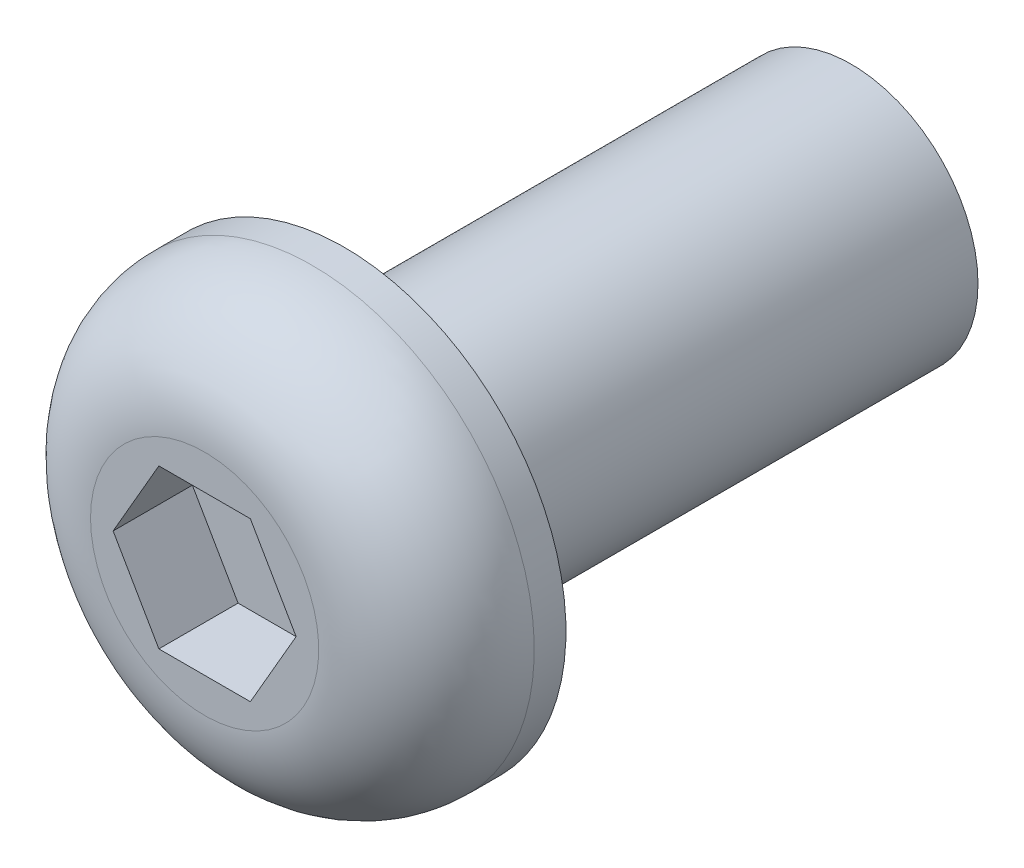
from build123d import *

# Parameters (mm, degrees)
SKETCH1_R          = 4
EXTRUDE1_DEPTH     = 16
CUT_EXTRUDE1_DEPTH = 2.5


with BuildPart() as part:
    # Sketch1 → Extrude1 (new body)
    with BuildSketch(Plane.XY):
        Circle(SKETCH1_R)
    extrude(amount=-EXTRUDE1_DEPTH)

    # Sketch2 → Revolve1 (revolve)
    with BuildSketch(Plane(origin=(0, 0, 0), x_dir=(0, 0, -1), z_dir=(1, 0, 0)), mode=Mode.PRIVATE) as revolve1_sk:
        with BuildLine():
            Line((0, 0), (0, 7))
            Line((0, 7), (-1, 7))
            ThreePointArc((-1, 7), (-3.404163056, 6.004163056), (-4.4, 3.6))
            Line((-4.4, 3.6), (-4.4, 0))
            Line((-4.4, 0), (0, 0))
        make_face()
    revolve(revolve1_sk.sketch.rotate(Axis((0, 0, 0), (0, 0, 1)), 90), axis=Axis((0, 0, 0), (0, 0, 1)))

    # Sketch3 → Cut-Extrude1 (cut)
    with BuildSketch(Plane.XY.offset(4.4)):
        Polygon((-1.443375673, 2.5), (-2.886751346, 0), (-1.443375673, -2.5), (1.443375673, -2.5), (2.886751346, 0), (1.443375673, 2.5), align=None)
    extrude(amount=-CUT_EXTRUDE1_DEPTH, mode=Mode.SUBTRACT)


solid = part.part
